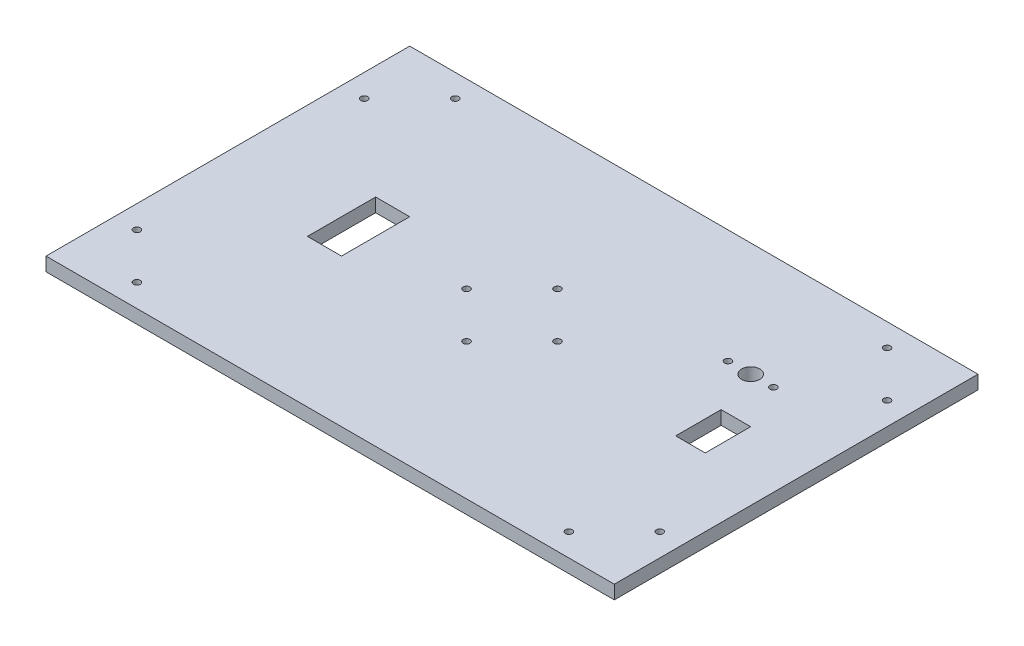
from build123d import *

# Parameters (mm, degrees)
SKETCH_1_W          = 250
SKETCH_1_H          = 160
EXTRUDE_1_DEPTH     = 6
SKETCH_2_R          = 1.5
CUT_EXTRUDE_1_DEPTH = 6
SKETCH_3_R          = 1.5
SKETCH_3_R_2        = 4
SKETCH_3_W          = 13
SKETCH_3_H          = 20
CUT_EXTRUDE_2_DEPTH = 6
SKETCH_4_W          = 15
SKETCH_4_H          = 30
CUT_EXTRUDE_3_DEPTH = 6


with BuildPart() as part:
    # Эскиз1 → Бобышка-Вытянуть1 (new body)
    with BuildSketch(Plane(origin=(0, 0, 0), x_dir=(1, 0, 0), z_dir=(0, 1, 0))):
        with Locations((55.297029703, 1.056105611)):
            Rectangle(SKETCH_1_W, SKETCH_1_H)
    extrude(amount=EXTRUDE_1_DEPTH)

    # Эскиз2 → Вырез-Вытянуть1 (cut)
    with BuildSketch(Plane(origin=(0, 6, 0), x_dir=(1, 0, 0), z_dir=(0, 1, 0))):
        with Locations(Location((-39.702970297, 71.056105611, 0), (0, 0, 270))):
            Circle(SKETCH_2_R)
        with Locations(Location((-59.702970297, 51.056105611, 0), (0, 0, 90))):
            Circle(SKETCH_2_R)
        with Locations(Location((150.297029703, 71.056105611, 0), (0, 0, 90))):
            Circle(SKETCH_2_R)
        with Locations(Location((170.297029703, 51.056105611, 0), (0, 0, 270))):
            Circle(SKETCH_2_R)
        with Locations(Location((170.297029703, -48.943894389, 0), (0, 0, 90))):
            Circle(SKETCH_2_R)
        with Locations(Location((150.297029703, -68.943894389, 0), (0, 0, 270))):
            Circle(SKETCH_2_R)
        with Locations(Location((-59.702970297, -48.943894389, 0), (0, 0, 270))):
            Circle(SKETCH_2_R)
        with Locations(Location((-39.702970297, -68.943894389, 0), (0, 0, 90))):
            Circle(SKETCH_2_R)
        with Locations(Location((35.297029703, 1.056105611, 0), (0, 0, 270))):
            Circle(SKETCH_2_R)
        with Locations(Location((55.297029703, 21.056105611, 0), (0, 0, 90))):
            Circle(SKETCH_2_R)
        with Locations(Location((55.297029703, -18.943894389, 0), (0, 0, 90))):
            Circle(SKETCH_2_R)
        with Locations(Location((75.297029703, 1.056105611, 0), (0, 0, 270))):
            Circle(SKETCH_2_R)
    extrude(amount=-CUT_EXTRUDE_1_DEPTH, mode=Mode.SUBTRACT)

    # Эскиз3 → Вырез-Вытянуть2 (cut)
    with BuildSketch(Plane(origin=(0, 6, 0), x_dir=(1, 0, 0), z_dir=(0, 1, 0))):
        with Locations(Location((140.297029703, 31.056105611, 0), (0, 0, 270))):
            Circle(SKETCH_3_R)
        with Locations(Location((120.297029703, 31.056105611, 0), (0, 0, 270))):
            Circle(SKETCH_3_R)
        with Locations(Location((130.297029703, 31.056105611, 0), (0, 0, 270))):
            Circle(SKETCH_3_R_2)
        with Locations((143.797029703, 1.056105611)):
            Rectangle(SKETCH_3_W, SKETCH_3_H)
    extrude(amount=-CUT_EXTRUDE_2_DEPTH, mode=Mode.SUBTRACT)

    # Эскиз4 → Вырез-Вытянуть3 (cut)
    with BuildSketch(Plane(origin=(0, 6, 0), x_dir=(1, 0, 0), z_dir=(0, 1, 0))):
        with Locations((-12.202970297, 1.056105611)):
            Rectangle(SKETCH_4_W, SKETCH_4_H)
    extrude(amount=-CUT_EXTRUDE_3_DEPTH, mode=Mode.SUBTRACT)


solid = part.part
